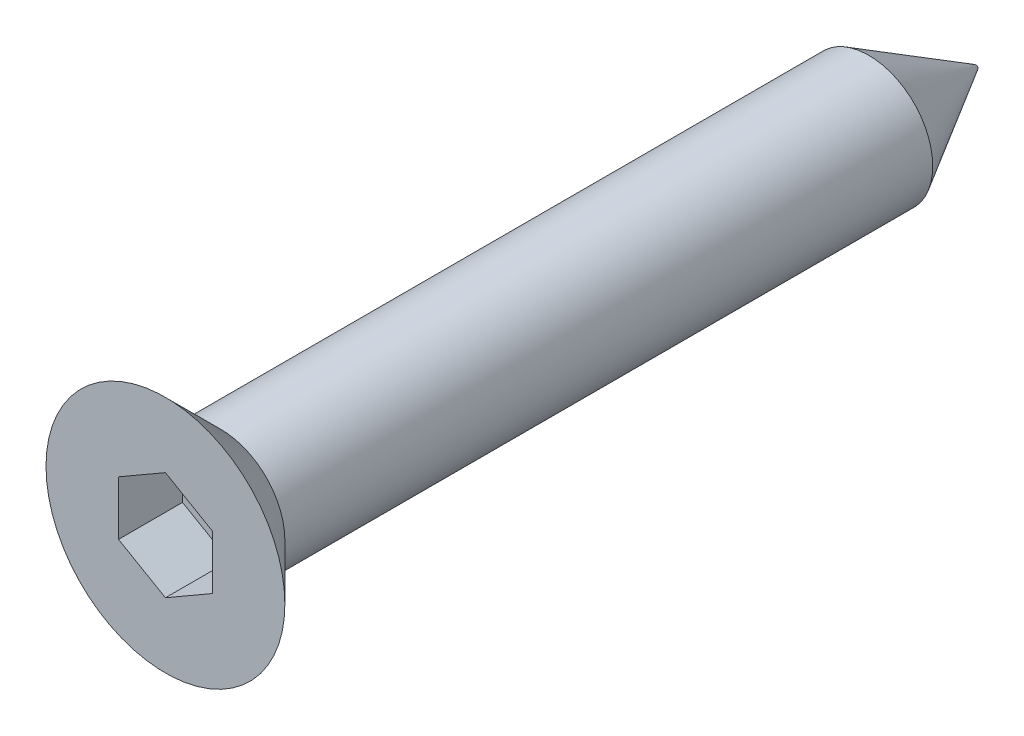
from build123d import *

# Parameters (mm, degrees)
ESQUISSE3_R             = 1.5
EXTRUSION1_DEPTH        = 19
ENL_V_MAT_EXTRU_2_DEPTH = 1.5
CHANFREIN1_SIZE         = 1.45
CHANFREIN1_SIZE2        = 2.511473671


with BuildPart() as part:
    # Esquisse1 → Révolution2 (revolve)
    with BuildSketch(Plane(origin=(0, 0, 0), x_dir=(0, 0, -1), z_dir=(1, 0, 0)), mode=Mode.PRIVATE) as r_volution2_sk:
        Polygon((0, 2.8), (1.3, 1.5), (1.3, 0), (0, 0), align=None)
    revolve(r_volution2_sk.sketch.rotate(Axis((0, 0, 1.603508429), (0, 0, -1)), 90), axis=Axis((0, 0, 1.603508429), (0, 0, -1)))

    # Esquisse3 → Extrusion1 (add)
    with BuildSketch(Plane.XY):
        Circle(ESQUISSE3_R)
    extrude(amount=-EXTRUSION1_DEPTH)

    # Esquisse2 → Enlèv. mat.-Extru.2 (cut)
    with BuildSketch(Plane.XY):
        Polygon((0, 1.270170592), (-1.1, 0.635085296), (-1.1, -0.635085296), (0, -1.270170592), (1.1, -0.635085296), (1.1, 0.635085296), align=None)
    extrude(amount=-ENL_V_MAT_EXTRU_2_DEPTH, mode=Mode.SUBTRACT)

    # Chanfrein1
    chanfrein1_edges = [part.edges().sort_by_distance(p)[0] for p in [
        (-1.5, 0, -19),
    ]]
    chanfrein1_side = [part.faces().sort_by_distance(p)[0] for p in [
        (0, 0, -19),
    ]]
    chamfer(chanfrein1_edges, length=CHANFREIN1_SIZE, length2=CHANFREIN1_SIZE2, reference=chanfrein1_side[0])


solid = part.part
